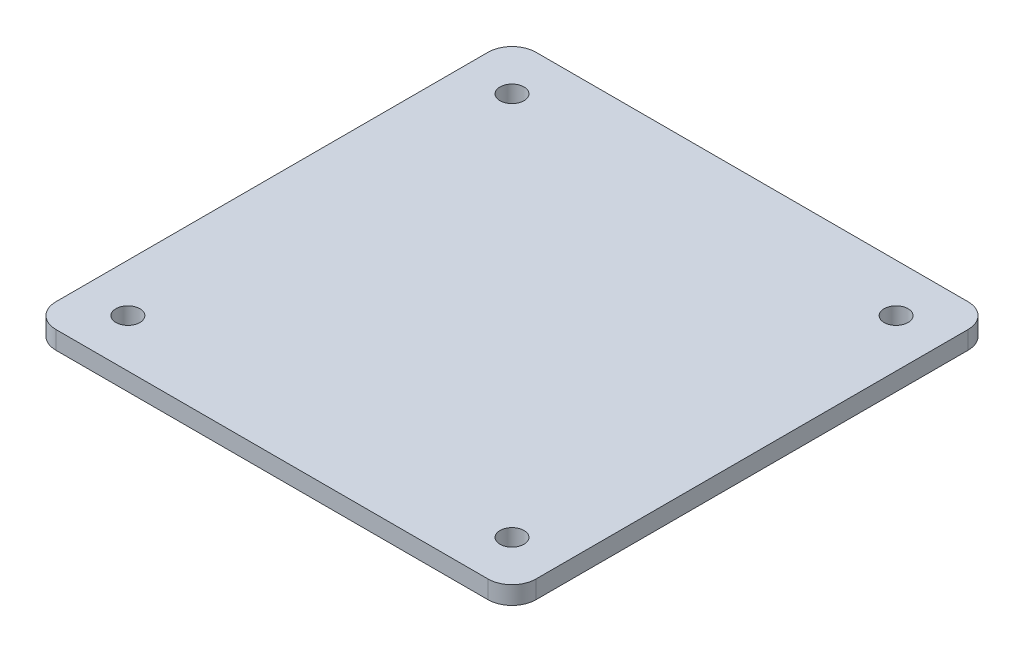
from build123d import *

# Parameters (mm, degrees)
BOSS_EXTRU_1_DEPTH      = 3
ESQUISSE2_R             = 2
ENL_V_MAT_EXTRU_1_DEPTH = 57.648036153


with BuildPart() as part:
    # Esquisse1 → Boss.-Extru.1 (new body)
    with BuildSketch(Plane(origin=(0, 0, 0), x_dir=(1, 0, 0), z_dir=(0, 1, 0))):
        with BuildLine():
            Line((-36, 40), (36, 40))
            ThreePointArc((36, 40), (38.828427125, 38.828427125), (40, 36))
            Line((40, 36), (40, -36))
            ThreePointArc((40, -36), (38.828427125, -38.828427125), (36, -40))
            Line((36, -40), (-36, -40))
            ThreePointArc((-36, -40), (-38.828427125, -38.828427125), (-40, -36))
            Line((-40, -36), (-40, 36))
            ThreePointArc((-40, 36), (-38.828427125, 38.828427125), (-36, 40))
        make_face()
    extrude(amount=BOSS_EXTRU_1_DEPTH)

    # Esquisse2 → Enlèv. mat.-Extru.1 (cut, through all)
    with BuildSketch(Plane(origin=(0, 3, 0), x_dir=(1, 0, 0), z_dir=(0, 1, 0))):
        with Locations(Location((-32, 32, 0), (0, 0, 270))):
            Circle(ESQUISSE2_R)
        with Locations(Location((32, 32, 0), (0, 0, 270))):
            Circle(ESQUISSE2_R)
        with Locations(Location((32, -32, 0), (0, 0, 270))):
            Circle(ESQUISSE2_R)
        with Locations(Location((-32, -32, 0), (0, 0, 270))):
            Circle(ESQUISSE2_R)
    extrude(amount=-ENL_V_MAT_EXTRU_1_DEPTH, mode=Mode.SUBTRACT)


solid = part.part
